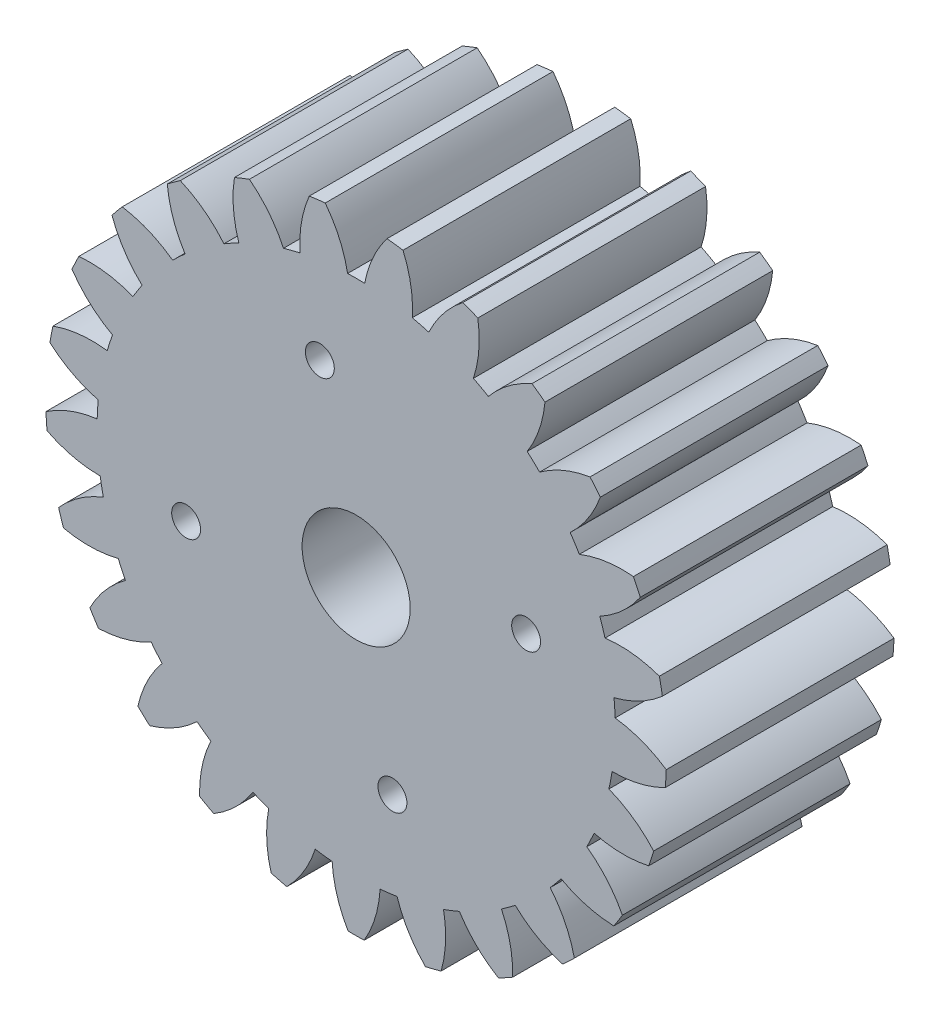
from build123d import *

# Parameters (mm, degrees)
SKETCH1_R               = 76.397015783
BOSS_EXTRUDE1_DEPTH     = 10
SKETCH2_R               = 339.401339096
CUT_EXTRUDE1_DEPTH      = 229.15779348
CUT_EXTRUDE2_DEPTH      = 158.108105162
CUT_EXTRUDE2_DEPTH_BACK = 158.108105162
SKETCH3_R               = 2.373
SKETCH3_R_2             = 0.635


with BuildPart() as part:
    # Sketch1 → Boss-Extrude1 (new body)
    with BuildSketch(Plane.XY):
        Circle(SKETCH1_R)
    extrude(amount=BOSS_EXTRUDE1_DEPTH)

    # Sketch2 → Cut-Extrude1 (cut, through all)
    with BuildSketch(Plane(origin=(-22.987963593, -120.609036011, 58.027753333), x_dir=(1, 0, 0), z_dir=(0, 0, 1))):
        with Locations((28.701811852, 128.515043202)):
            Circle(SKETCH2_R)
        with BuildLine():
            ThreePointArc((33.387694455, 141.311043875), (32.528453615, 140.46157323), (31.891870266, 139.434608363))
            ThreePointArc((31.891870266, 139.434608363), (31.530908009, 139.533645243), (31.166882991, 139.620753457))
            ThreePointArc((31.166882991, 139.620753457), (31.103784848, 140.827365997), (30.760061964, 141.98570523))
            ThreePointArc((30.760061964, 141.98570523), (30.409727826, 142.034590236), (30.058242872, 142.074365599))
            ThreePointArc((30.058242872, 142.074365599), (29.437251422, 141.037898129), (29.076063287, 139.884885411))
            ThreePointArc((29.076063287, 139.884885411), (28.701811852, 139.891043202), (28.327560417, 139.884885411))
            ThreePointArc((28.327560417, 139.884885411), (27.966372282, 141.037898129), (27.345380832, 142.074365599))
            ThreePointArc((27.345380832, 142.074365599), (26.993895878, 142.034590236), (26.64356174, 141.98570523))
            ThreePointArc((26.64356174, 141.98570523), (26.299838857, 140.827365997), (26.236740714, 139.620753457))
            ThreePointArc((26.236740714, 139.620753457), (25.872715696, 139.533645243), (25.511753438, 139.434608363))
            ThreePointArc((25.511753438, 139.434608363), (24.87517009, 140.46157323), (24.01592925, 141.311043875))
            ThreePointArc((24.01592925, 141.311043875), (23.685378573, 141.185107375), (23.358208033, 141.050633623))
            ThreePointArc((23.358208033, 141.050633623), (23.313351088, 139.843205343), (23.552307626, 138.658808884))
            ThreePointArc((23.552307626, 138.658808884), (23.221382056, 138.483907994), (22.896389562, 138.298214877))
            ThreePointArc((22.896389562, 138.298214877), (22.024409873, 139.134603913), (20.980908905, 139.743702368))
            ThreePointArc((20.980908905, 139.743702368), (20.692062219, 139.539517784), (20.408612605, 139.327904768))
            ThreePointArc((20.408612605, 139.327904768), (20.665440127, 138.147254599), (21.191436828, 137.059494207))
            ThreePointArc((21.191436828, 137.059494207), (20.914403975, 136.807790307), (20.645801718, 136.547108734))
            ThreePointArc((20.645801718, 136.547108734), (19.59321538, 137.14036854), (18.431021287, 137.470822909))
            ThreePointArc((18.431021287, 137.470822909), (18.202027893, 137.20121991), (17.980109387, 136.925764054))
            ThreePointArc((17.980109387, 136.925764054), (18.522483957, 135.846076588), (19.302470513, 134.923300249))
            ThreePointArc((19.302470513, 134.923300249), (19.096737372, 134.610608821), (18.90140262, 134.291318375))
            ThreePointArc((18.90140262, 134.291318375), (17.734347502, 134.604172255), (16.526485215, 134.635218875))
            ThreePointArc((16.526485215, 134.635218875), (16.371733608, 134.317137608), (16.225290166, 133.995146815))
            ThreePointArc((16.225290166, 133.995146815), (17.019132396, 133.084262788), (18.004099383, 132.384451933))
            ThreePointArc((18.004099383, 132.384451933), (17.882592923, 132.03042053), (17.772799276, 131.672583402))
            ThreePointArc((17.772799276, 131.672583402), (16.564605745, 131.685373597), (15.386969692, 131.415061694))
            ThreePointArc((15.386969692, 131.415061694), (15.316183486, 131.068488375), (15.254416688, 130.720194513))
            ThreePointArc((15.254416688, 130.720194513), (16.249846551, 130.035348117), (17.377904871, 129.602474436))
            ThreePointArc((17.377904871, 129.602474436), (17.34825979, 129.229348152), (17.330905987, 128.855448566))
            ThreePointArc((17.330905987, 128.855448566), (16.157489285, 128.567371421), (15.084074671, 128.012685686))
            ThreePointArc((15.084074671, 128.012685686), (15.101701624, 127.659396792), (15.128492505, 127.306684443))
            ThreePointArc((15.128492505, 127.306684443), (16.262963481, 126.890907096), (17.463233081, 126.752169635))
            ThreePointArc((17.463233081, 126.752169635), (17.527312088, 126.383393367), (17.603488533, 126.016924809))
            ThreePointArc((17.603488533, 126.016924809), (16.538578747, 125.44608127), (15.63683216, 124.641874648))
            ThreePointArc((15.63683216, 124.641874648), (15.741764705, 124.304068619), (15.855429895, 123.969099999))
            ThreePointArc((15.855429895, 123.969099999), (17.057659, 123.848516521), (18.254722528, 124.012632663))
            ThreePointArc((18.254722528, 124.012632663), (18.408499303, 123.671377981), (18.57341955, 123.335367018))
            ThreePointArc((18.57341955, 123.335367018), (17.683928879, 122.517625284), (17.010510372, 121.514429035))
            ThreePointArc((17.010510372, 121.514429035), (17.196155211, 121.213331466), (17.389552709, 120.917153885))
            ThreePointArc((17.389552709, 120.917153885), (18.583999468, 121.099340979), (19.702641019, 121.555998704))
            ThreePointArc((19.702641019, 121.555998704), (19.936453202, 121.263707894), (20.179754704, 120.979267331))
            ThreePointArc((20.179754704, 120.979267331), (19.521573118, 119.966009123), (19.118796054, 118.826857757))
            ThreePointArc((19.118796054, 118.826857757), (19.37348844, 118.581387716), (19.634466369, 118.342611099))
            ThreePointArc((19.634466369, 118.342611099), (20.746079299, 118.81612128), (21.71601051, 119.536627105))
            ThreePointArc((21.71601051, 119.536627105), (22.015166822, 119.311665874), (22.321562051, 119.096668157))
            ThreePointArc((22.321562051, 119.096668157), (21.93604552, 117.951560214), (21.829217863, 116.7480308))
            ThreePointArc((21.829217863, 116.7480308), (22.136954535, 116.573612073), (22.449114692, 116.407239634))
            ThreePointArc((22.449114692, 116.407239634), (23.408047065, 117.142320516), (24.168323591, 118.081402409))
            ThreePointArc((24.168323591, 118.081402409), (24.514026941, 117.937905898), (24.864263958, 117.805860125))
            ThreePointArc((24.864263958, 117.805860125), (24.775635903, 116.600853791), (24.971470027, 115.408568509))
            ThreePointArc((24.971470027, 115.408568509), (25.31291476, 115.316160465), (25.656642975, 115.232645997))
            ThreePointArc((25.656642975, 115.232645997), (26.402641541, 116.183109745), (26.905492413, 117.281761737))
            ThreePointArc((26.905492413, 117.281761737), (27.276020987, 117.228746359), (27.648093113, 117.187949452))
            ThreePointArc((27.648093113, 117.187949452), (27.86192236, 115.998759706), (28.348113288, 114.892634225))
            ThreePointArc((28.348113288, 114.892634225), (28.701811852, 114.888043202), (29.055510417, 114.892634225))
            ThreePointArc((29.055510417, 114.892634225), (29.541701344, 115.998759706), (29.755530591, 117.187949452))
            ThreePointArc((29.755530591, 117.187949452), (30.127602717, 117.228746359), (30.498131292, 117.281761737))
            ThreePointArc((30.498131292, 117.281761737), (31.000982163, 116.183109745), (31.74698073, 115.232645997))
            ThreePointArc((31.74698073, 115.232645997), (32.090708945, 115.316160465), (32.432153677, 115.408568509))
            ThreePointArc((32.432153677, 115.408568509), (32.627987802, 116.600853791), (32.539359746, 117.805860125))
            ThreePointArc((32.539359746, 117.805860125), (32.889596763, 117.937905898), (33.235300113, 118.081402409))
            ThreePointArc((33.235300113, 118.081402409), (33.99557664, 117.142320516), (34.954509012, 116.407239634))
            ThreePointArc((34.954509012, 116.407239634), (35.266669169, 116.573612073), (35.574405842, 116.7480308))
            ThreePointArc((35.574405842, 116.7480308), (35.467578185, 117.951560214), (35.082061653, 119.096668157))
            ThreePointArc((35.082061653, 119.096668157), (35.388456882, 119.311665874), (35.687613194, 119.536627105))
            ThreePointArc((35.687613194, 119.536627105), (36.657544406, 118.81612128), (37.769157336, 118.342611099))
            ThreePointArc((37.769157336, 118.342611099), (38.030135265, 118.581387716), (38.28482765, 118.826857757))
            ThreePointArc((38.28482765, 118.826857757), (37.882050586, 119.966009123), (37.223869, 120.979267331))
            ThreePointArc((37.223869, 120.979267331), (37.467170502, 121.263707894), (37.700982685, 121.555998704))
            ThreePointArc((37.700982685, 121.555998704), (38.819624236, 121.099340979), (40.014070995, 120.917153885))
            ThreePointArc((40.014070995, 120.917153885), (40.207468493, 121.213331466), (40.393113332, 121.514429035))
            ThreePointArc((40.393113332, 121.514429035), (39.719694826, 122.517625284), (38.830204155, 123.335367018))
            ThreePointArc((38.830204155, 123.335367018), (38.995124401, 123.671377981), (39.148901176, 124.012632663))
            ThreePointArc((39.148901176, 124.012632663), (40.345964704, 123.848516521), (41.54819381, 123.969099999))
            ThreePointArc((41.54819381, 123.969099999), (41.661859, 124.304068619), (41.766791544, 124.641874648))
            ThreePointArc((41.766791544, 124.641874648), (40.865044957, 125.44608127), (39.800135171, 126.016924809))
            ThreePointArc((39.800135171, 126.016924809), (39.876311616, 126.383393367), (39.940390623, 126.752169635))
            ThreePointArc((39.940390623, 126.752169635), (41.140660224, 126.890907096), (42.2751312, 127.306684443))
            ThreePointArc((42.2751312, 127.306684443), (42.30192208, 127.659396792), (42.319549033, 128.012685686))
            ThreePointArc((42.319549033, 128.012685686), (41.246134419, 128.567371421), (40.072717717, 128.855448566))
            ThreePointArc((40.072717717, 128.855448566), (40.055363915, 129.229348152), (40.025718833, 129.602474436))
            ThreePointArc((40.025718833, 129.602474436), (41.153777153, 130.035348117), (42.149207016, 130.720194513))
            ThreePointArc((42.149207016, 130.720194513), (42.087440218, 131.068488375), (42.016654012, 131.415061694))
            ThreePointArc((42.016654012, 131.415061694), (40.839017959, 131.685373597), (39.630824428, 131.672583402))
            ThreePointArc((39.630824428, 131.672583402), (39.521030781, 132.03042053), (39.399524321, 132.384451933))
            ThreePointArc((39.399524321, 132.384451933), (40.384491308, 133.084262788), (41.178333538, 133.995146815))
            ThreePointArc((41.178333538, 133.995146815), (41.031890096, 134.317137608), (40.87713849, 134.635218875))
            ThreePointArc((40.87713849, 134.635218875), (39.669276202, 134.604172255), (38.502221085, 134.291318375))
            ThreePointArc((38.502221085, 134.291318375), (38.306886333, 134.610608821), (38.101153191, 134.923300249))
            ThreePointArc((38.101153191, 134.923300249), (38.881139747, 135.846076588), (39.423514317, 136.925764054))
            ThreePointArc((39.423514317, 136.925764054), (39.201595811, 137.20121991), (38.972602417, 137.470822909))
            ThreePointArc((38.972602417, 137.470822909), (37.810408325, 137.14036854), (36.757821986, 136.547108734))
            ThreePointArc((36.757821986, 136.547108734), (36.489219729, 136.807790307), (36.212186877, 137.059494207))
            ThreePointArc((36.212186877, 137.059494207), (36.738183577, 138.147254599), (36.995011099, 139.327904768))
            ThreePointArc((36.995011099, 139.327904768), (36.711561485, 139.539517784), (36.4227148, 139.743702368))
            ThreePointArc((36.4227148, 139.743702368), (35.379213832, 139.134603913), (34.507234143, 138.298214877))
            ThreePointArc((34.507234143, 138.298214877), (34.182241649, 138.483907994), (33.851316078, 138.658808884))
            ThreePointArc((33.851316078, 138.658808884), (34.090272616, 139.843205343), (34.045415672, 141.050633623))
            ThreePointArc((34.045415672, 141.050633623), (33.718245132, 141.185107375), (33.387694455, 141.311043875))
        make_face(mode=Mode.SUBTRACT)
    extrude(amount=-CUT_EXTRUDE1_DEPTH, mode=Mode.SUBTRACT)

    # Sketch3 → Cut-Extrude2 (cut, two sides: drawn at the far end of the back side and taken through both)
    with BuildSketch(Plane(origin=(-22.987963593, -120.609036011, 52.027753333), x_dir=(-1, 0, 0), z_dir=(0, 0, -1)).offset(-CUT_EXTRUDE2_DEPTH_BACK)):
        with Locations(Location((-28.701811852, 128.515043202, 0), (0, 0, 180))):
            Circle(SKETCH3_R)
        with Locations(Location((-21.237298675, 126.921571421, 0), (0, 0, 180))):
            Circle(SKETCH3_R_2)
        with Locations(Location((-27.108340072, 135.979556379, 0), (0, 0, 180))):
            Circle(SKETCH3_R_2)
        with Locations(Location((-36.16632503, 130.108514982, 0), (0, 0, 180))):
            Circle(SKETCH3_R_2)
        with Locations(Location((-30.295283632, 121.050530024, 0), (0, 0, 180))):
            Circle(SKETCH3_R_2)
    extrude(amount=CUT_EXTRUDE2_DEPTH + CUT_EXTRUDE2_DEPTH_BACK, mode=Mode.SUBTRACT)


solid = part.part
